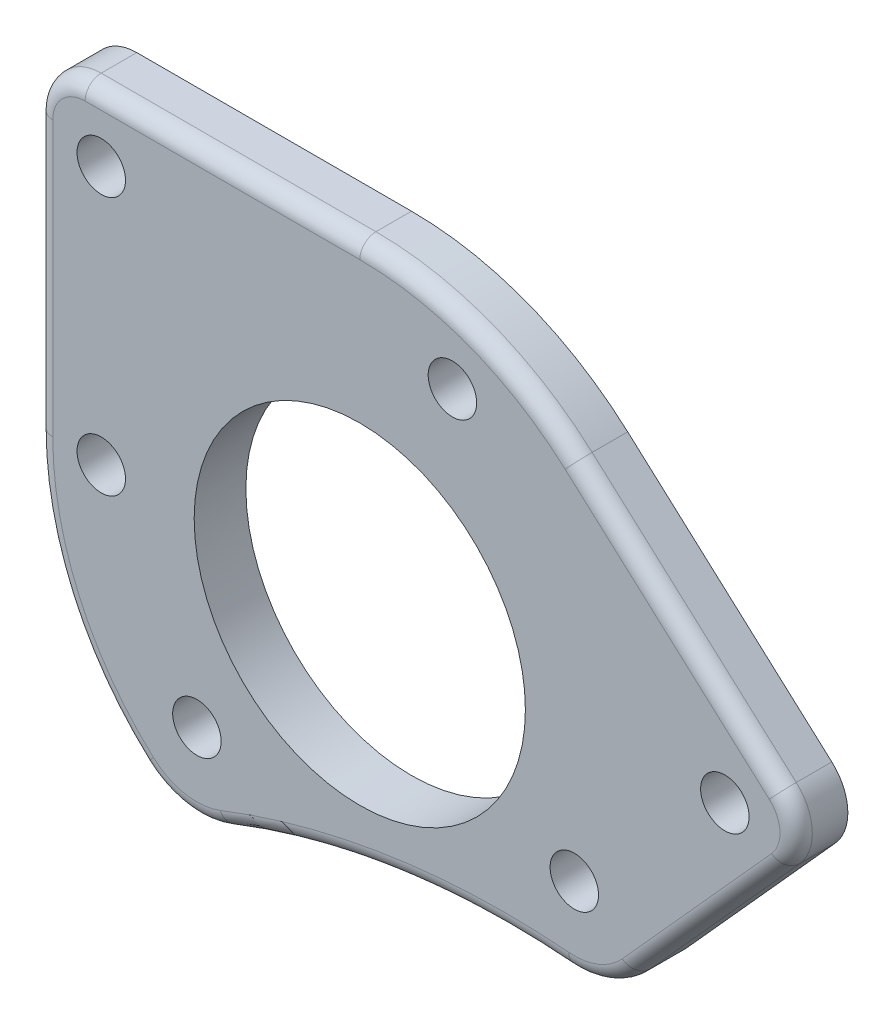
from build123d import *

# Parameters (mm, degrees)
SKETCH_1_R      = 10.25
SKETCH_1_R_2    = 1.5
EXTRUDE_1_DEPTH = 3.2
FILLET_1_R      = 1


with BuildPart() as part:
    # 草图1 → 凸台-拉伸1 (new body)
    with BuildSketch(Plane.XY):
        with BuildLine():
            Line((4.334015044, 74.86289651), (16.967477077, 63.487676201))
            ThreePointArc((16.967477077, 63.487676201), (17.955973862, 61.415249594), (17.189519734, 59.250849906))
            Line((17.189519734, 59.250849906), (7.944957082, 48.983722931))
            ThreePointArc((7.944957082, 48.983722931), (6.077132686, 47.683381281), (3.826448864, 47.345625871))
            ThreePointArc((3.826448864, 47.345625871), (-6.917114554, 46.993654106), (-17.306435746, 44.235023248))
            ThreePointArc((-17.306435746, 44.235023248), (-20.032995202, 43.973894607), (-22.488022071, 45.188455313))
            ThreePointArc((-22.488022071, 45.188455313), (-27.335046982, 51.900262342), (-29.048597084, 60))
            Line((-29.048597084, 60), (-29.048597084, 77))
            ThreePointArc((-29.048597084, 77), (-28.169917427, 79.121320344), (-26.048597084, 80))
            Line((-26.048597084, 80), (-9.048597084, 80))
            ThreePointArc((-9.048597084, 80), (-1.881238093, 78.67160853), (4.334015044, 74.86289651))
        make_face()
        with Locations((-9.048597084, 60)):
            Circle(SKETCH_1_R, mode=Mode.SUBTRACT)
        with Locations((-25.048597084, 76)):
            Circle(SKETCH_1_R_2, mode=Mode.SUBTRACT)
        with Locations((-3.314709891, 74.937286824)):
            Circle(SKETCH_1_R_2, mode=Mode.SUBTRACT)
        with Locations((-25.048597084, 60)):
            Circle(SKETCH_1_R_2, mode=Mode.SUBTRACT)
        with Locations((-19.128165824, 48.891341485)):
            Circle(SKETCH_1_R_2, mode=Mode.SUBTRACT)
        with Locations((4.229232955, 52.329375962)):
            Circle(SKETCH_1_R_2, mode=Mode.SUBTRACT)
        with Locations((13.547809826, 61.184227506)):
            Circle(SKETCH_1_R_2, mode=Mode.SUBTRACT)
    extrude(amount=EXTRUDE_1_DEPTH)

    # 圆角1
    fillet_1_edges = [part.edges().sort_by_distance(p)[0] for p in [
        (-29.048597084, 68.5, 3.2),
        (-28.169917427, 79.121320344, 3.2),
        (-17.548597084, 80, 3.2),
        (-1.881238093, 78.67160853, 3.2),
        (10.65074606, 69.175286355, 3.2),
        (17.955973862, 61.415249594, 3.2),
        (12.567238408, 54.117286418, 3.2),
        (6.077132686, 47.683381281, 3.2),
        (-6.917114554, 46.993654106, 3.2),
        (-20.032995202, 43.973894607, 3.2),
        (-27.335046982, 51.900262342, 3.2),
    ]]
    fillet(fillet_1_edges, radius=FILLET_1_R)


solid = part.part
